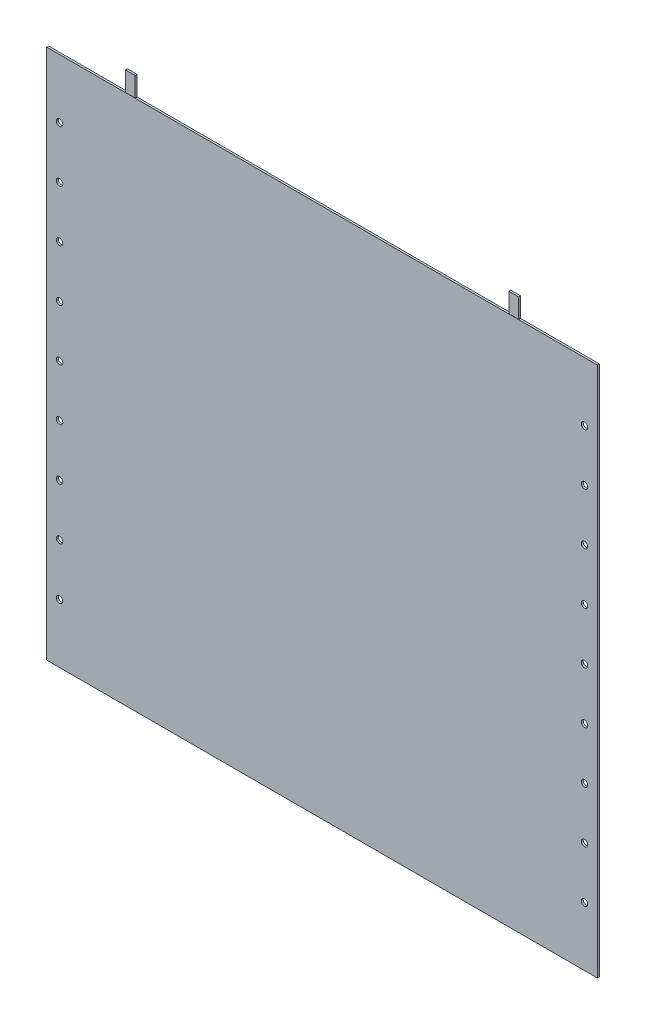
from build123d import *

# Parameters (mm, degrees)
SKETCH1_R           = 1.65
BOSS_EXTRUDE1_DEPTH = 1
SKETCH2_W           = 5
SKETCH2_H           = 0.1
CUT_EXTRUDE1_DEPTH  = 0.1


with BuildPart() as part:
    # Sketch1 → Boss-Extrude1 (new body)
    with BuildSketch(Plane.XY):
        Polygon((-140, 135), (-100, 135), (-100, 145), (-95, 145), (-95, 135), (95, 135), (95, 145), (100, 145), (100, 135), (140, 135), (140, -135), (-140, -135), align=None)
        with Locations((-133.5, 0)):
            Circle(SKETCH1_R, mode=Mode.SUBTRACT)
        with Locations((-133.5, 26.25)):
            Circle(SKETCH1_R, mode=Mode.SUBTRACT)
        with Locations((-133.5, 52.5)):
            Circle(SKETCH1_R, mode=Mode.SUBTRACT)
        with Locations((-133.5, 78.75)):
            Circle(SKETCH1_R, mode=Mode.SUBTRACT)
        with Locations((-133.5, 105)):
            Circle(SKETCH1_R, mode=Mode.SUBTRACT)
        with Locations((-133.5, -26.25)):
            Circle(SKETCH1_R, mode=Mode.SUBTRACT)
        with Locations((-133.5, -52.5)):
            Circle(SKETCH1_R, mode=Mode.SUBTRACT)
        with Locations((-133.5, -78.75)):
            Circle(SKETCH1_R, mode=Mode.SUBTRACT)
        with Locations((-133.5, -105)):
            Circle(SKETCH1_R, mode=Mode.SUBTRACT)
        with Locations(Location((133.5, -105, 0), (0, 0, 180))):
            Circle(SKETCH1_R, mode=Mode.SUBTRACT)
        with Locations(Location((133.5, -78.75, 0), (0, 0, 180))):
            Circle(SKETCH1_R, mode=Mode.SUBTRACT)
        with Locations(Location((133.5, -52.5, 0), (0, 0, 180))):
            Circle(SKETCH1_R, mode=Mode.SUBTRACT)
        with Locations(Location((133.5, -26.25, 0), (0, 0, 180))):
            Circle(SKETCH1_R, mode=Mode.SUBTRACT)
        with Locations(Location((133.5, 105, 0), (0, 0, 180))):
            Circle(SKETCH1_R, mode=Mode.SUBTRACT)
        with Locations(Location((133.5, 78.75, 0), (0, 0, 180))):
            Circle(SKETCH1_R, mode=Mode.SUBTRACT)
        with Locations(Location((133.5, 52.5, 0), (0, 0, 180))):
            Circle(SKETCH1_R, mode=Mode.SUBTRACT)
        with Locations(Location((133.5, 26.25, 0), (0, 0, 180))):
            Circle(SKETCH1_R, mode=Mode.SUBTRACT)
        with Locations(Location((133.5, 0, 0), (0, 0, 180))):
            Circle(SKETCH1_R, mode=Mode.SUBTRACT)
    extrude(amount=BOSS_EXTRUDE1_DEPTH)

    # Sketch2 → Cut-Extrude1 (cut)
    with BuildSketch(Plane.XY.offset(1)):
        with Locations((-97.5, 135.05)):
            Rectangle(SKETCH2_W, SKETCH2_H)
        with Locations((97.5, 135.05)):
            Rectangle(SKETCH2_W, SKETCH2_H)
    extrude(amount=-CUT_EXTRUDE1_DEPTH, mode=Mode.SUBTRACT)


solid = part.part
